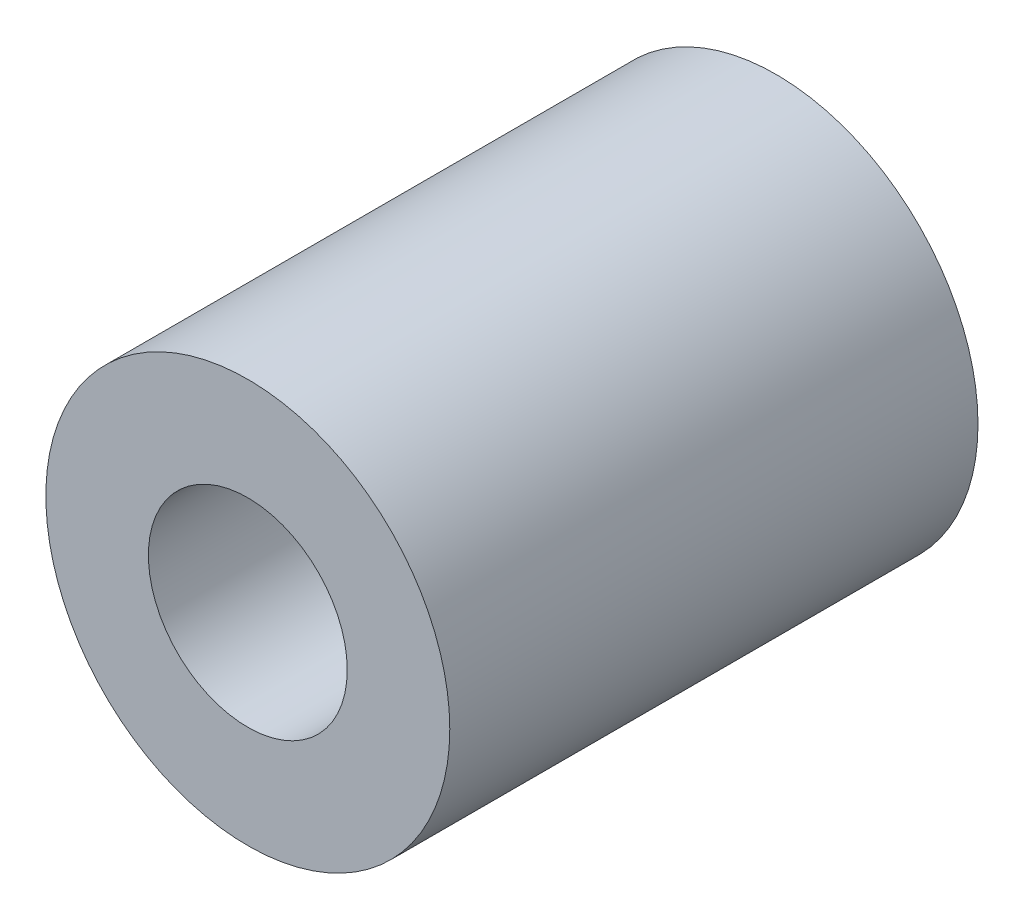
from build123d import *

# Parameters (mm, degrees)
CROQUIS1_R              = 3.25
SALIENTE_EXTRUIR1_DEPTH = 8.5
CROQUIS2_R              = 1.6
CORTAR_EXTRUIR1_DEPTH   = 9


with BuildPart() as part:
    # Croquis1 → Saliente-Extruir1 (new body)
    with BuildSketch(Plane.XY):
        Circle(CROQUIS1_R)
    extrude(amount=SALIENTE_EXTRUIR1_DEPTH)

    # Croquis2 → Cortar-Extruir1 (cut)
    with BuildSketch(Plane.XY.offset(8.5)):
        Circle(CROQUIS2_R)
    extrude(amount=-CORTAR_EXTRUIR1_DEPTH, mode=Mode.SUBTRACT)


solid = part.part
